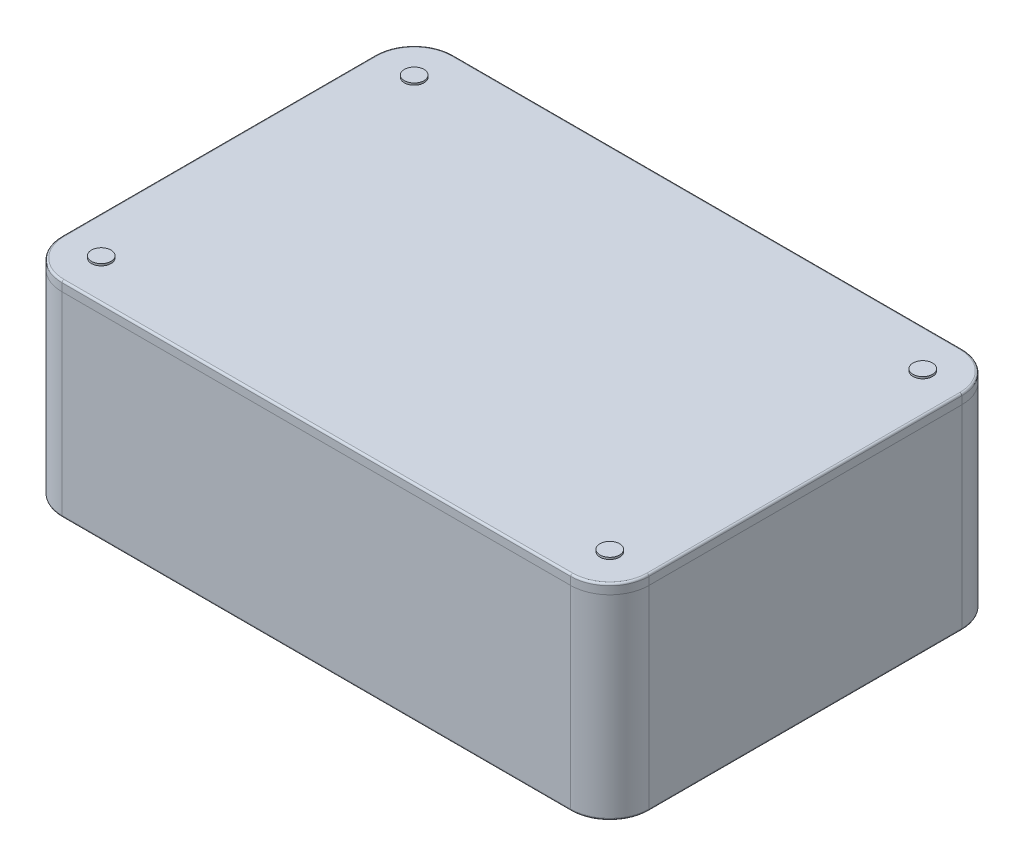
from build123d import *

# Parameters (mm, degrees)
CROQUIS1_W            = 300
CROQUIS1_H            = 200
EXTRUIR1_DEPTH        = 100
REDONDEO1_R           = 20
VACIADO1_T            = -4
EXTRUIR2_DEPTH        = 5
REDONDEO2_R           = 1
CROQUIS3_R            = 5
EXTRUIR3_DEPTH        = 1
EXTRUIR3_2_DEPTH      = 1
EXTRUIR3_3_DEPTH      = 1
EXTRUIR3_4_DEPTH      = 1
CROQUIS4_R            = 2.5
EXTRUIR4_DEPTH        = 102
CROQUIS5_R            = 4
CORTAR_EXTRUIR1_DEPTH = 10
REDONDEO3_R           = 1
CROQUIS6_R            = 5
CROQUIS6_R_2          = 3
EXTRUIR5_DEPTH        = 10


with BuildPart() as part:
    # Croquis1 → Extruir1 (new body)
    with BuildSketch(Plane(origin=(0, 0, 0), x_dir=(1, 0, 0), z_dir=(0, 1, 0))):
        Rectangle(CROQUIS1_W, CROQUIS1_H)
    extrude(amount=EXTRUIR1_DEPTH)

    # Redondeo1
    redondeo1_edges = [part.edges().sort_by_distance(p)[0] for p in [
        (-150, 50, -100),
        (150, 50, -100),
        (150, 50, 100),
        (-150, 50, 100),
    ]]
    fillet(redondeo1_edges, radius=REDONDEO1_R)

    # Vaciado1
    vaciado1_openings = [part.faces().sort_by_distance(p)[0] for p in [
        (0, 100, 0),
    ]]
    offset(amount=VACIADO1_T, openings=vaciado1_openings, kind=Kind.INTERSECTION)

    # Croquis5 → Cortar-Extruir1 (cut)
    with BuildSketch(Plane(origin=(0, 4, 0), x_dir=(1, 0, 0), z_dir=(0, 1, 0))):
        with Locations(Location((-101, 26, 0), (0, 0, 270))):
            Circle(CROQUIS5_R)
        with Locations(Location((-101, -26, 0), (0, 0, 270))):
            Circle(CROQUIS5_R)
        with Locations(Location((-21, 26, 0), (0, 0, 270))):
            Circle(CROQUIS5_R)
        with Locations(Location((-21, -26, 0), (0, 0, 270))):
            Circle(CROQUIS5_R)
        with Locations(Location((49, 26, 0), (0, 0, 270))):
            Circle(CROQUIS5_R)
        with Locations(Location((49, -26, 0), (0, 0, 270))):
            Circle(CROQUIS5_R)
        with Locations(Location((109, 0, 0), (0, 0, 270))):
            Circle(CROQUIS5_R)
    extrude(amount=-CORTAR_EXTRUIR1_DEPTH, mode=Mode.SUBTRACT)

    # Redondeo3
    redondeo3_edges = [part.edges().sort_by_distance(p)[0] for p in [
        (-150, 0, 0),
        (0, 0, -100),
        (150, 0, 0),
        (0, 0, 100),
        (-144.142135624, 0, 94.142135624),
        (144.142135624, 0, 94.142135624),
        (144.142135624, 0, -94.142135624),
        (-144.142135624, 0, -94.142135624),
    ]]
    fillet(redondeo3_edges, radius=REDONDEO3_R)

    # Croquis6 → Extruir5 (cut)
    with BuildSketch(Plane(origin=(0, 0, -100), x_dir=(-1, 0, 0), z_dir=(0, 0, -1))):
        with Locations((105, 50.5)):
            Circle(CROQUIS6_R)
        with Locations((-45, 50.5)):
            Circle(CROQUIS6_R)
        with Locations((-105, 50.5)):
            Circle(CROQUIS6_R_2)
    extrude(amount=-EXTRUIR5_DEPTH, mode=Mode.SUBTRACT)


with BuildPart() as body_2:
    # Croquis2 → Extruir2 (new body)
    with BuildSketch(Plane(origin=(0, 100, 0), x_dir=(1, 0, 0), z_dir=(0, 1, 0))):
        with BuildLine():
            Line((130, 100), (-130, 100))
            ThreePointArc((-130, 100), (-144.142135624, 94.142135624), (-150, 80))
            Line((-150, 80), (-150, -80))
            ThreePointArc((-150, -80), (-144.142135624, -94.142135624), (-130, -100))
            Line((-130, -100), (130, -100))
            ThreePointArc((130, -100), (144.142135624, -94.142135624), (150, -80))
            Line((150, -80), (150, 80))
            ThreePointArc((150, 80), (144.142135624, 94.142135624), (130, 100))
        make_face()
    extrude(amount=EXTRUIR2_DEPTH)

    # Redondeo2
    redondeo2_edges = [body_2.edges().sort_by_distance(p)[0] for p in [
        (-144.142135624, 105, -94.142135624),
        (-150, 105, 0),
        (-144.142135624, 105, 94.142135624),
        (0, 105, 100),
        (144.142135624, 105, 94.142135624),
        (150, 105, 0),
        (144.142135624, 105, -94.142135624),
        (0, 105, -100),
    ]]
    fillet(redondeo2_edges, radius=REDONDEO2_R)


with BuildPart() as body_3:
    # Croquis3 → Extruir3 (new body)
    with BuildSketch(Plane(origin=(0, 105, 0), x_dir=(1, 0, 0), z_dir=(0, 1, 0))):
        with Locations(Location((-130, 80, 0), (0, 0, 270))):
            Circle(CROQUIS3_R)
    extrude(amount=EXTRUIR3_DEPTH)


with BuildPart() as body_4:
    # Croquis3 → Extruir3 2 (new body)
    with BuildSketch(Plane(origin=(0, 105, 0), x_dir=(1, 0, 0), z_dir=(0, 1, 0))):
        with Locations(Location((130, 80, 0), (0, 0, 90))):
            Circle(CROQUIS3_R)
    extrude(amount=EXTRUIR3_2_DEPTH)


with BuildPart() as body_5:
    # Croquis3 → Extruir3 3 (new body)
    with BuildSketch(Plane(origin=(0, 105, 0), x_dir=(1, 0, 0), z_dir=(0, 1, 0))):
        with Locations(Location((130, -80, 0), (0, 0, 270))):
            Circle(CROQUIS3_R)
    extrude(amount=EXTRUIR3_3_DEPTH)


with BuildPart() as body_6:
    # Croquis3 → Extruir3 4 (new body)
    with BuildSketch(Plane(origin=(0, 105, 0), x_dir=(1, 0, 0), z_dir=(0, 1, 0))):
        with Locations(Location((-130, -80, 0), (0, 0, 90))):
            Circle(CROQUIS3_R)
    extrude(amount=EXTRUIR3_4_DEPTH)


    add(body_5.part)  # Extruir4 merges body 5

    add(body_3.part)  # Extruir4 merges body 3

    add(body_4.part)  # Extruir4 merges body 4
    # Croquis4 → Extruir4 (add)
    with BuildSketch(Plane(origin=(0, 106, 0), x_dir=(1, 0, 0), z_dir=(0, 1, 0))):
        with Locations(Location((-130, 80, 0), (0, 0, 270))):
            Circle(CROQUIS4_R)
        with Locations(Location((130, 80, 0), (0, 0, 270))):
            Circle(CROQUIS4_R)
        with Locations(Location((130, -80, 0), (0, 0, 270))):
            Circle(CROQUIS4_R)
        with Locations(Location((-130, -80, 0), (0, 0, 270))):
            Circle(CROQUIS4_R)
    extrude(amount=-EXTRUIR4_DEPTH)


solid = Compound([part.part, body_2.part, body_6.part])
